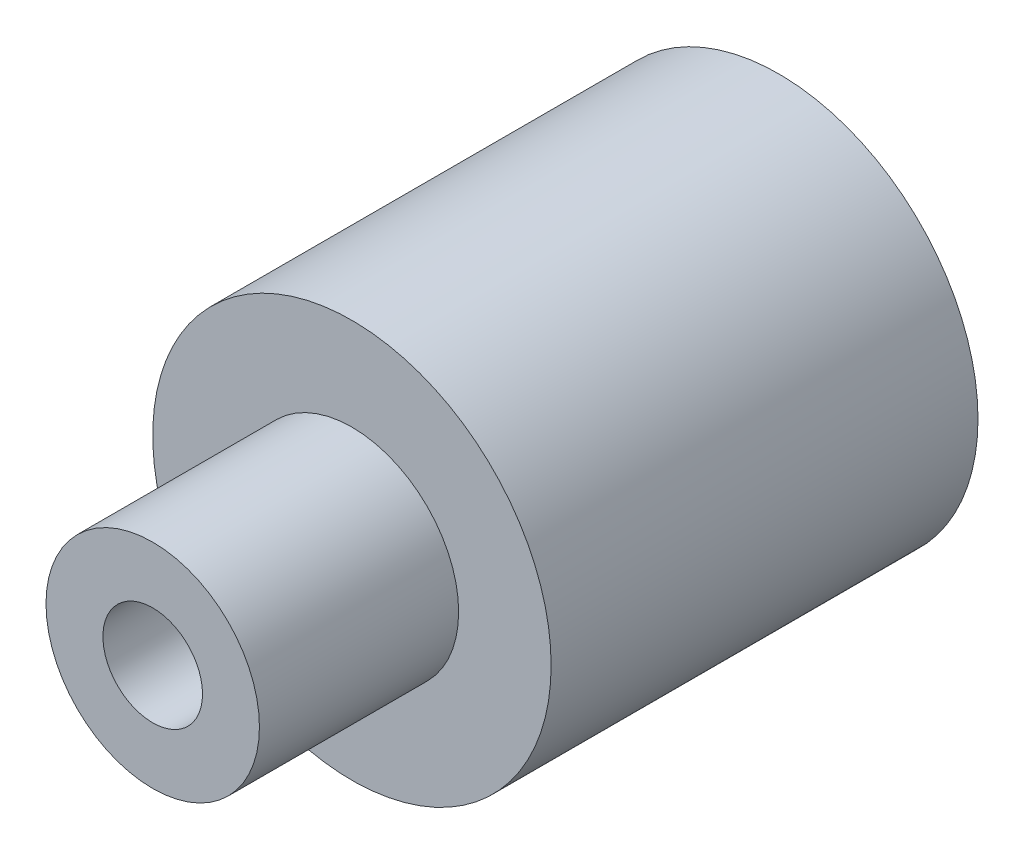
from build123d import *

# Parameters (mm, degrees)
SKETCH1_R           = 7
BOSS_EXTRUDE1_DEPTH = 15
SKETCH2_R           = 3.75
BOSS_EXTRUDE2_DEPTH = 7
SKETCH3_R           = 1.75
CUT_EXTRUDE1_DEPTH  = 22


with BuildPart() as part:
    # Sketch1 → Boss-Extrude1 (new body)
    with BuildSketch(Plane(origin=(0, 0, 0), x_dir=(0, 1, 0), z_dir=(0, 0, 1))):
        with Locations(Location((0, 0, 0), (0, 0, 270))):
            Circle(SKETCH1_R)
    extrude(amount=BOSS_EXTRUDE1_DEPTH)

    # Sketch2 → Boss-Extrude2 (add)
    with BuildSketch(Plane.XY.offset(15)):
        Circle(SKETCH2_R)
    extrude(amount=BOSS_EXTRUDE2_DEPTH)

    # Sketch3 → Cut-Extrude1 (cut)
    with BuildSketch(Plane.XY.offset(22)):
        Circle(SKETCH3_R)
    extrude(amount=-CUT_EXTRUDE1_DEPTH, mode=Mode.SUBTRACT)


solid = part.part
